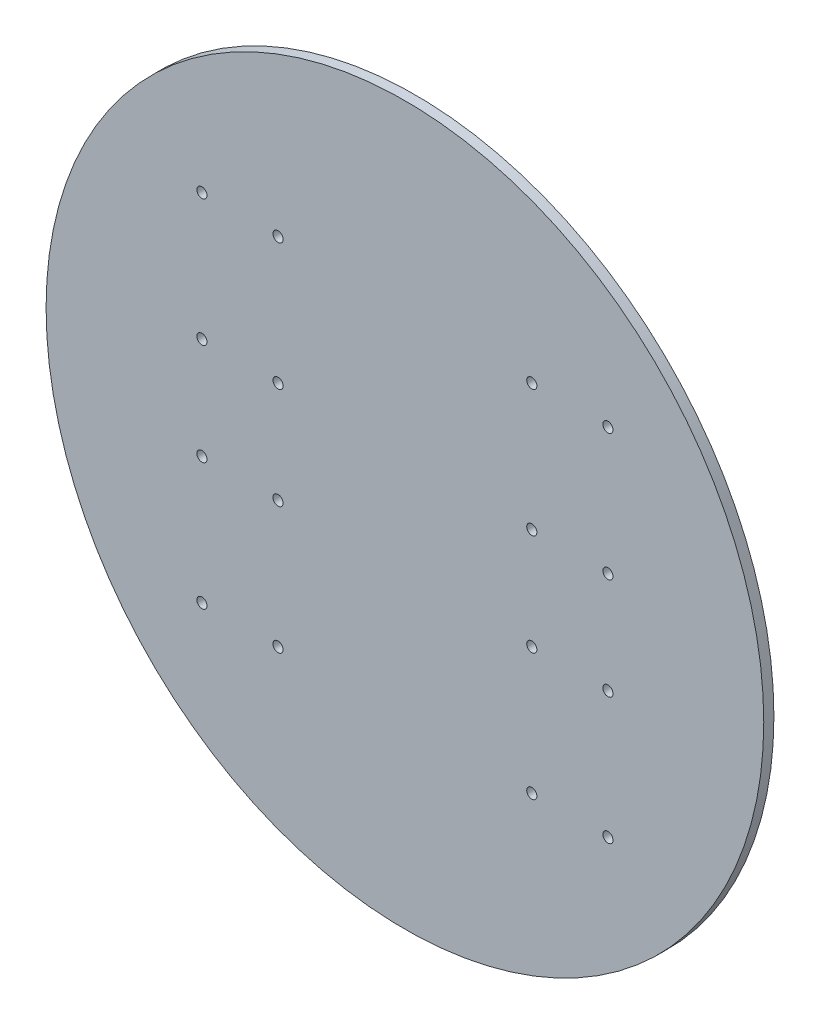
from build123d import *

# Parameters (mm, degrees)
SKETCH_1_R               = 70.710678119
EXTRUDE_1_DEPTH          = 2
SKETCH_2_R               = 1
CUT_EXTRUDE_4_DEPTH      = 101.019998
MIRROR_6_COPY_1_SKETCH_R = 1
MIRROR_6_COPY_1_DEPTH    = 101.019998


with BuildPart() as part:
    # ｽｹｯﾁ1 → ﾎﾞｽ - 押し出し1 (new body)
    with BuildSketch(Plane.XY):
        Circle(SKETCH_1_R)
    extrude(amount=EXTRUDE_1_DEPTH)

    # ｽｹｯﾁ2 → ｶｯﾄ - 押し出し4 (cut, symmetric)
    with BuildSketch(Plane.XY):
        with Locations((25, -10)):
            Circle(SKETCH_2_R)
        with Locations((40, -10)):
            Circle(SKETCH_2_R)
        with Locations((25, -35)):
            Circle(SKETCH_2_R)
        with Locations((40, -35)):
            Circle(SKETCH_2_R)
    cut_extrude_4 = extrude(amount=CUT_EXTRUDE_4_DEPTH, both=True, mode=Mode.SUBTRACT)

    # ﾐﾗｰ2: ｶｯﾄ - 押し出し4 across plane
    add(cut_extrude_4.mirror(Plane(origin=(0, 0, 0), x_dir=(0, 0, 1), z_dir=(1, 0, 0))), mode=Mode.SUBTRACT)

    # ﾐﾗｰ6: ｶｯﾄ - 押し出し4 across plane
    add(cut_extrude_4.mirror(Plane.ZX), mode=Mode.SUBTRACT)

    # ﾐﾗｰ6 copy 1 sketch → ﾐﾗｰ6 copy 1 (cut, symmetric)
    with BuildSketch(Plane(origin=(0, 0, 0), x_dir=(-1, 0, 0), z_dir=(0, 0, 1))):
        with Locations((25, -10)):
            Circle(MIRROR_6_COPY_1_SKETCH_R)
        with Locations((40, -10)):
            Circle(MIRROR_6_COPY_1_SKETCH_R)
        with Locations((25, -35)):
            Circle(MIRROR_6_COPY_1_SKETCH_R)
        with Locations((40, -35)):
            Circle(MIRROR_6_COPY_1_SKETCH_R)
    extrude(amount=MIRROR_6_COPY_1_DEPTH, both=True, mode=Mode.SUBTRACT)


solid = part.part
